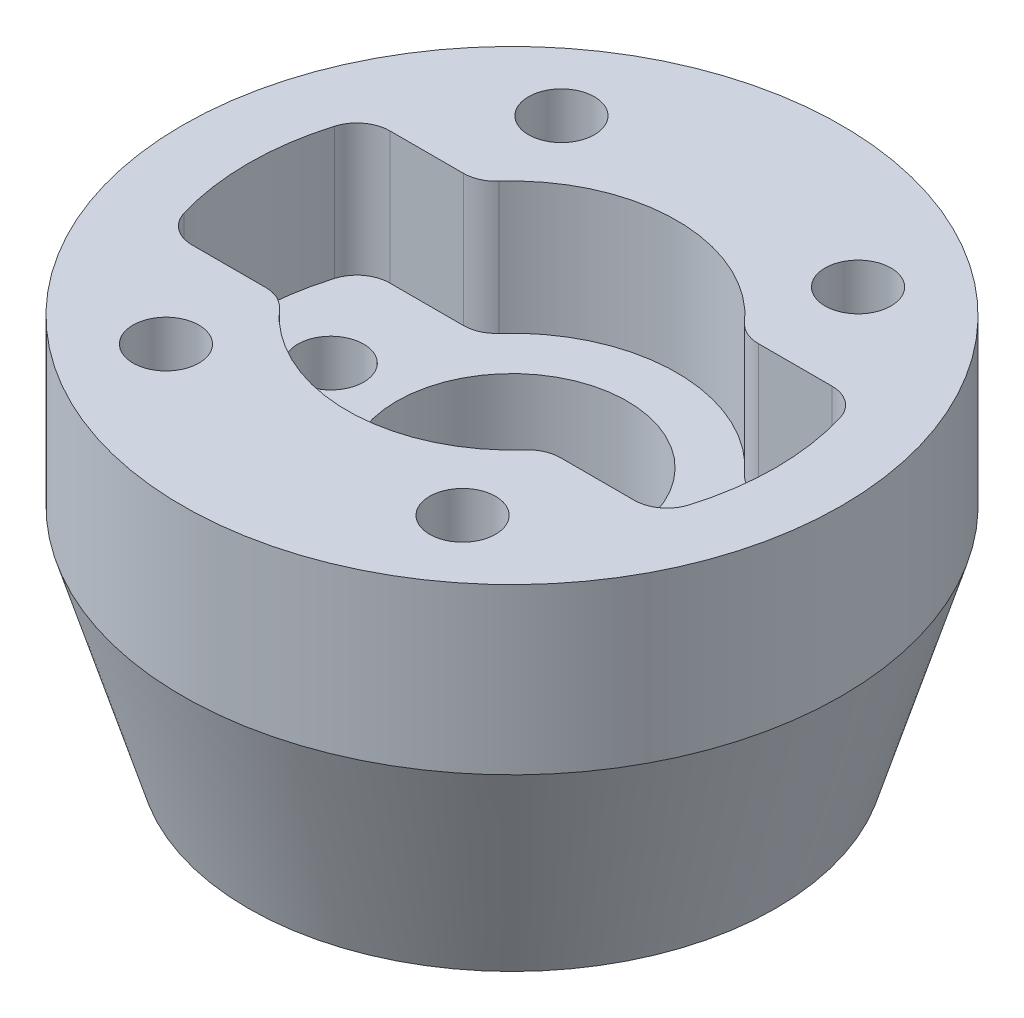
from build123d import *

# Parameters (mm, degrees)
CUT_EXTRUDE_1_DEPTH = 4
FILLET_1_R          = 1
SKETCH_3_R          = 1
CUT_EXTRUDE_2_DEPTH = 4
SKETCH_4_R          = 1
CUT_EXTRUDE_3_DEPTH = 4


with BuildPart() as part:
    # 草图1 → 旋转1 (revolve)
    with BuildSketch(Plane.XY, mode=Mode.PRIVATE) as revolve_1_sk:
        Polygon((2, 0), (2, 2), (3, 2), (3, 4), (3.5, 4), (3.5, 12.5), (10, 12.5), (10, 7.5), (8, 0.918629754), (2.2, 0), align=None)
    revolve(revolve_1_sk.sketch.rotate(Axis((0, 0.286130796, 0), (0, -1, 0)), 180), axis=Axis((0, 0.286130796, 0), (0, -1, 0)))

    # 草图2 → 切除-拉伸1 (cut)
    with BuildSketch(Plane(origin=(0, 12.5, 0), x_dir=(1, 0, 0), z_dir=(0, 1, 0))):
        with BuildLine():
            Line((-7.416198487, 3), (-4, 3))
            ThreePointArc((-4, 3), (0, 5), (4, 3))
            Line((4, 3), (7.416198487, 3))
            ThreePointArc((7.416198487, 3), (8, 0), (7.416198487, -3))
            Line((7.416198487, -3), (4, -3))
            ThreePointArc((4, -3), (0, -5), (-4, -3))
            Line((-4, -3), (-7.416198487, -3))
            ThreePointArc((-7.416198487, -3), (-8, 0), (-7.416198487, 3))
        make_face()
    extrude(amount=-CUT_EXTRUDE_1_DEPTH, mode=Mode.SUBTRACT)

    # 圆角1
    fillet_1_edges = [part.edges().sort_by_distance(p)[0] for p in [
        (-7.416198487, 10.5, 3),
        (-7.416198487, 10.5, -3),
        (-4, 10.5, -3),
        (4, 10.5, -3),
        (7.416198487, 10.5, -3),
        (7.416198487, 10.5, 3),
        (4, 10.5, 3),
        (-4, 10.5, 3),
    ]]
    fillet(fillet_1_edges, radius=FILLET_1_R)

    # 草图3 → 切除-拉伸2 (cut)
    with BuildSketch(Plane(origin=(0, 8.5, 0), x_dir=(1, 0, 0), z_dir=(0, 1, 0))):
        with Locations(Location((5.5, 0, 0), (0, 0, 180))):
            Circle(SKETCH_3_R)
        with Locations((-5.5, 0)):
            Circle(SKETCH_3_R)
    extrude(amount=-CUT_EXTRUDE_2_DEPTH, mode=Mode.SUBTRACT)

    # 草图4 → 切除-拉伸3 (cut)
    with BuildSketch(Plane(origin=(0, 12.5, 0), x_dir=(1, 0, 0), z_dir=(0, 1, 0))):
        with Locations(Location((-4.5, 6, 0), (0, 0, 180))):
            Circle(SKETCH_4_R)
        with Locations(Location((4.5, 6, 0), (0, 0, 180))):
            Circle(SKETCH_4_R)
        with Locations(Location((-4.5, -6, 0), (0, 0, 180))):
            Circle(SKETCH_4_R)
        with Locations(Location((4.5, -6, 0), (0, 0, 180))):
            Circle(SKETCH_4_R)
    extrude(amount=-CUT_EXTRUDE_3_DEPTH, mode=Mode.SUBTRACT)


solid = part.part
